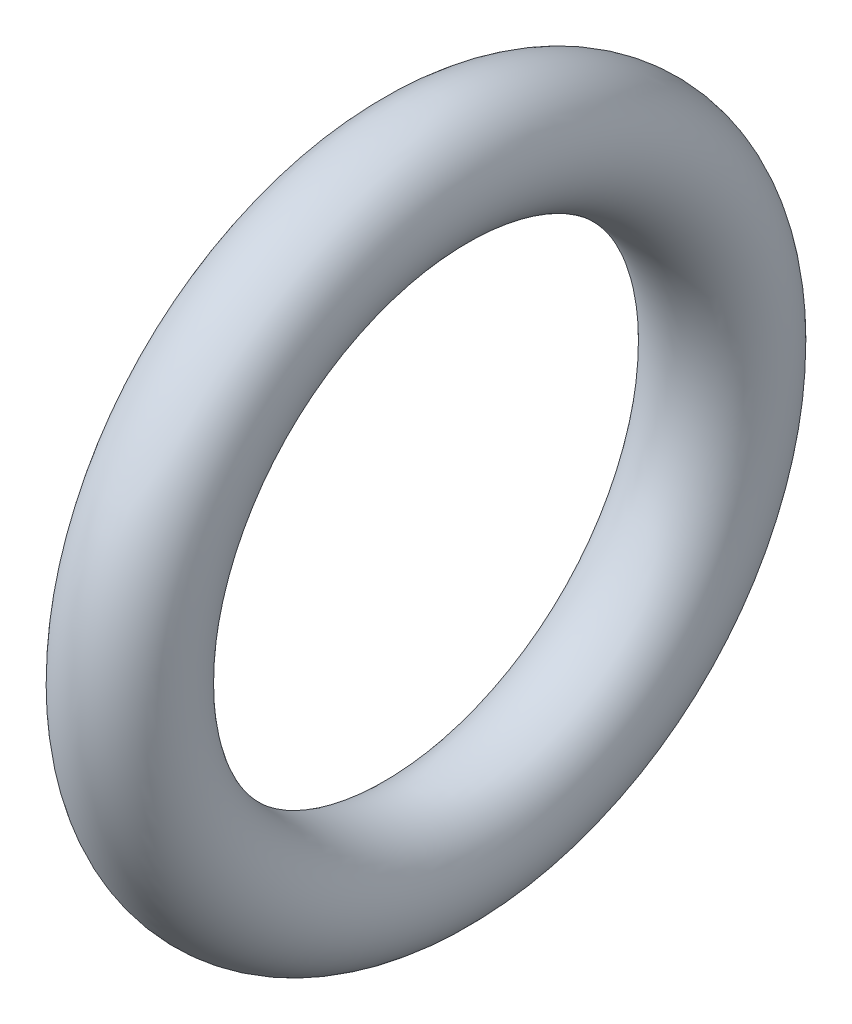
from build123d import *

# Parameters (mm, degrees)
ESQUISSE1_R = 1.25


with BuildPart() as part:
    # Esquisse1 → Révolution1 (revolve)
    with BuildSketch(Plane.XY, mode=Mode.PRIVATE) as r_volution1_sk:
        with Locations((0, 6.25)):
            Circle(ESQUISSE1_R)
    revolve(r_volution1_sk.sketch.rotate(Axis((-17.272, 0, 0), (1, 0, 0)), 90), axis=Axis((-17.272, 0, 0), (1, 0, 0)))


solid = part.part
